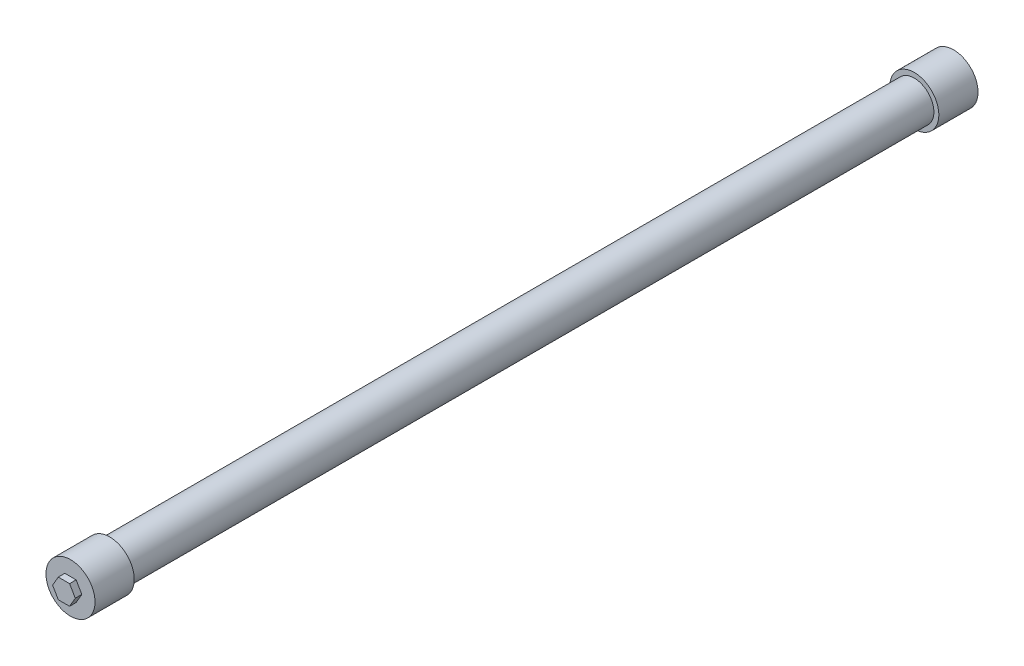
from build123d import *

# Parameters (mm, degrees)
CROQUIS1_R                   = 6
SALIENTE_EXTRUIR1_DEPTH      = 250
SALIENTE_EXTRUIR2_DEPTH      = 10
SALIENTE_EXTRUIR2_DEPTH_BACK = 2
CROQUIS2_R                   = 7.5
SALIENTE_EXTRUIR3_DEPTH      = 10
SALIENTE_EXTRUIR3_DEPTH_BACK = 2
CROQUIS3_R                   = 7.5
SALIENTE_EXTRUIR4_DEPTH      = 2
SALIENTE_EXTRUIR5_DEPTH      = 2


with BuildPart() as part:
    # Croquis1 → Saliente-Extruir1 (new body)
    with BuildSketch(Plane.XY):
        Circle(CROQUIS1_R)
    extrude(amount=SALIENTE_EXTRUIR1_DEPTH)

    # Croquis2 → Saliente-Extruir2 (add, two sides: drawn at the far end of the back side and taken through both)
    with BuildSketch(Plane.XY.offset(250).offset(-SALIENTE_EXTRUIR2_DEPTH_BACK)):
        Circle(CROQUIS2_R)
    extrude(amount=SALIENTE_EXTRUIR2_DEPTH + SALIENTE_EXTRUIR2_DEPTH_BACK)

    # Croquis3 → Saliente-Extruir3 (add, two sides: drawn at the far end of the back side and taken through both)
    with BuildSketch(Plane(origin=(0, 0, 0), x_dir=(-1, 0, 0), z_dir=(0, 0, -1)).offset(-SALIENTE_EXTRUIR3_DEPTH_BACK)):
        with Locations(Location((0, 0, 0), (0, 0, 180))):
            Circle(CROQUIS3_R)
    extrude(amount=SALIENTE_EXTRUIR3_DEPTH + SALIENTE_EXTRUIR3_DEPTH_BACK)

    # Croquis4 → Saliente-Extruir4 (add)
    with BuildSketch(Plane.XY.offset(260)):
        Polygon((3.464101615, 0), (1.732050808, 3), (-1.732050808, 3), (-3.464101615, 0), (-1.732050808, -3), (1.732050808, -3), align=None)
    extrude(amount=SALIENTE_EXTRUIR4_DEPTH)

    # Croquis5 → Saliente-Extruir5 (add)
    with BuildSketch(Plane(origin=(0, 0, -10), x_dir=(-1, 0, 0), z_dir=(0, 0, -1))):
        Polygon((1.963176251, 2.854109144), (-1.490142898, 3.127215078), (-3.45331915, 0.273105934), (-1.963176251, -2.854109144), (1.490142898, -3.127215078), (3.45331915, -0.273105934), align=None)
    extrude(amount=SALIENTE_EXTRUIR5_DEPTH)


solid = part.part
